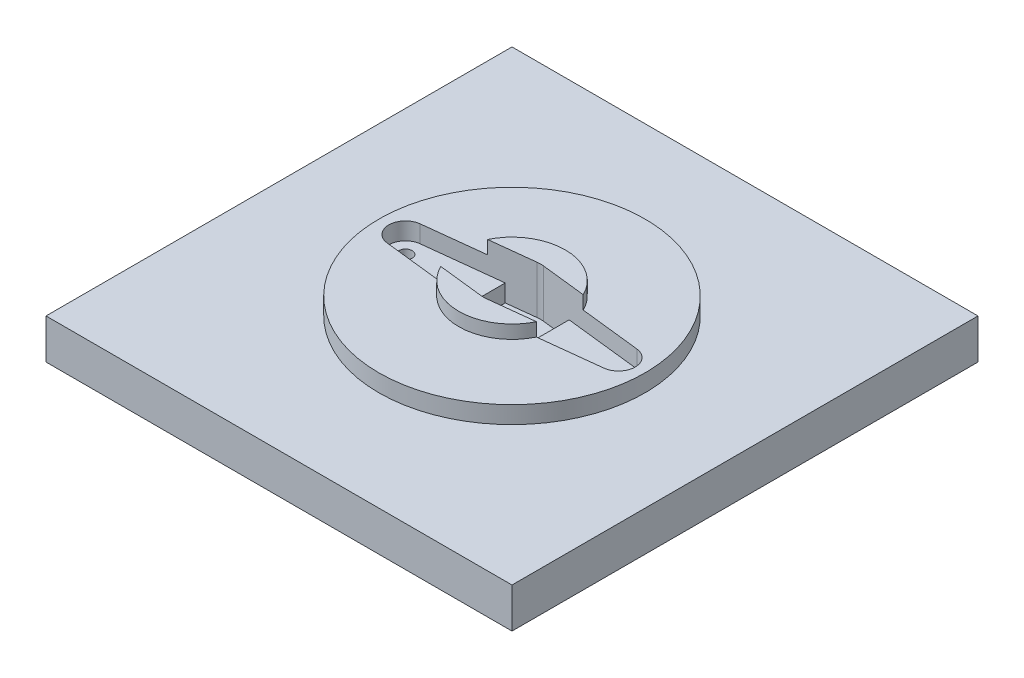
from build123d import *

# Parameters (mm, degrees)
SKETCH1_W           = 70
SKETCH1_H           = 70
BOSS_EXTRUDE1_DEPTH = 6
SKETCH2_R           = 20
BOSS_EXTRUDE6_DEPTH = 2.6
CUT_EXTRUDE1_START  = -2.6
CUT_EXTRUDE1_DEPTH  = 2.6
SKETCH4_R           = 3.5
CUT_EXTRUDE2_DEPTH  = 1.6
SKETCH5_R           = 1
CUT_EXTRUDE3_DEPTH  = 4.4
BOSS_EXTRUDE7_DEPTH = 2


with BuildPart() as part:
    # Sketch1 → Boss-Extrude1 (new body)
    with BuildSketch(Plane(origin=(0, 0, 0), x_dir=(1, 0, 0), z_dir=(0, 1, 0))):
        Rectangle(SKETCH1_W, SKETCH1_H)
    extrude(amount=BOSS_EXTRUDE1_DEPTH)

    # Sketch2 → Boss-Extrude6 (add)
    with BuildSketch(Plane(origin=(0, 6, 0), x_dir=(1, 0, 0), z_dir=(0, 1, 0))):
        with Locations(Location((0, 0, 0), (0, 0, 270))):
            Circle(SKETCH2_R)
        with BuildLine():
            Line((-16.28125, -2.484129312), (-0.48375, -4.272702416))
            ThreePointArc((-0.48375, -4.272702416), (0, -4.3), (0.48375, -4.272702416))
            Line((0.48375, -4.272702416), (16.28125, -2.484129312))
            ThreePointArc((16.28125, -2.484129312), (18.5, 0), (16.28125, 2.484129312))
            Line((16.28125, 2.484129312), (0.48375, 4.272702416))
            ThreePointArc((0.48375, 4.272702416), (0, 4.3), (-0.48375, 4.272702416))
            Line((-0.48375, 4.272702416), (-16.28125, 2.484129312))
            ThreePointArc((-16.28125, 2.484129312), (-18.5, 0), (-16.28125, -2.484129312))
        make_face(mode=Mode.SUBTRACT)
    extrude(amount=BOSS_EXTRUDE6_DEPTH)

    # Sketch3 → Cut-Extrude1 (cut)
    with BuildSketch(Plane(origin=(0, 6, 0), x_dir=(1, 0, 0), z_dir=(0, 1, 0)).offset(CUT_EXTRUDE1_START)):
        with BuildLine():
            Line((-4.8, 3.784022013), (-4.8, -3.784022013))
            Line((-4.8, -3.784022013), (-0.48375, -4.272702416))
            ThreePointArc((-0.48375, -4.272702416), (0, -4.3), (0.48375, -4.272702416))
            Line((0.48375, -4.272702416), (4.8, -3.784022013))
            Line((4.8, -3.784022013), (4.8, 3.784022013))
            Line((4.8, 3.784022013), (0.48375, 4.272702416))
            ThreePointArc((0.48375, 4.272702416), (0, 4.3), (-0.48375, 4.272702416))
            Line((-0.48375, 4.272702416), (-4.8, 3.784022013))
        make_face()
    extrude(amount=CUT_EXTRUDE1_DEPTH, mode=Mode.SUBTRACT)

    # Sketch4 → Cut-Extrude2 (cut)
    with BuildSketch(Plane.XZ):
        with Locations(Location((16, 0, 0), (0, 0, 90))):
            Circle(SKETCH4_R)
        with Locations(Location((-16, 0, 0), (0, 0, 270))):
            Circle(SKETCH4_R)
    extrude(amount=-CUT_EXTRUDE2_DEPTH, mode=Mode.SUBTRACT)

    # Sketch5 → Cut-Extrude3 (cut)
    with BuildSketch(Plane(origin=(0, 6, 0), x_dir=(1, 0, 0), z_dir=(0, 1, 0))):
        with Locations(Location((16, 0, 0), (0, 0, 270))):
            Circle(SKETCH5_R)
        with Locations(Location((-16, 0, 0), (0, 0, 90))):
            Circle(SKETCH5_R)
    extrude(amount=-CUT_EXTRUDE3_DEPTH, mode=Mode.SUBTRACT)

    # Sketch6 → Boss-Extrude7 (add)
    with BuildSketch(Plane(origin=(0, 8.6, 0), x_dir=(1, 0, 0), z_dir=(0, 1, 0))):
        with BuildLine():
            Line((7.187033827, 3.513765042), (0.48375, 4.272702416))
            ThreePointArc((0.48375, 4.272702416), (0, 4.3), (-0.48375, 4.272702416))
            Line((-0.48375, 4.272702416), (-7.187033827, 3.513765042))
            ThreePointArc((-7.187033827, 3.513765042), (0, 8), (7.187033827, 3.513765042))
        make_face()
        with BuildLine():
            Line((0.48375, -4.272702416), (7.187033827, -3.513765042))
            ThreePointArc((7.187033827, -3.513765042), (0, -8), (-7.187033827, -3.513765042))
            Line((-7.187033827, -3.513765042), (-0.48375, -4.272702416))
            ThreePointArc((-0.48375, -4.272702416), (0, -4.3), (0.48375, -4.272702416))
        make_face()
    extrude(amount=BOSS_EXTRUDE7_DEPTH)


solid = part.part
